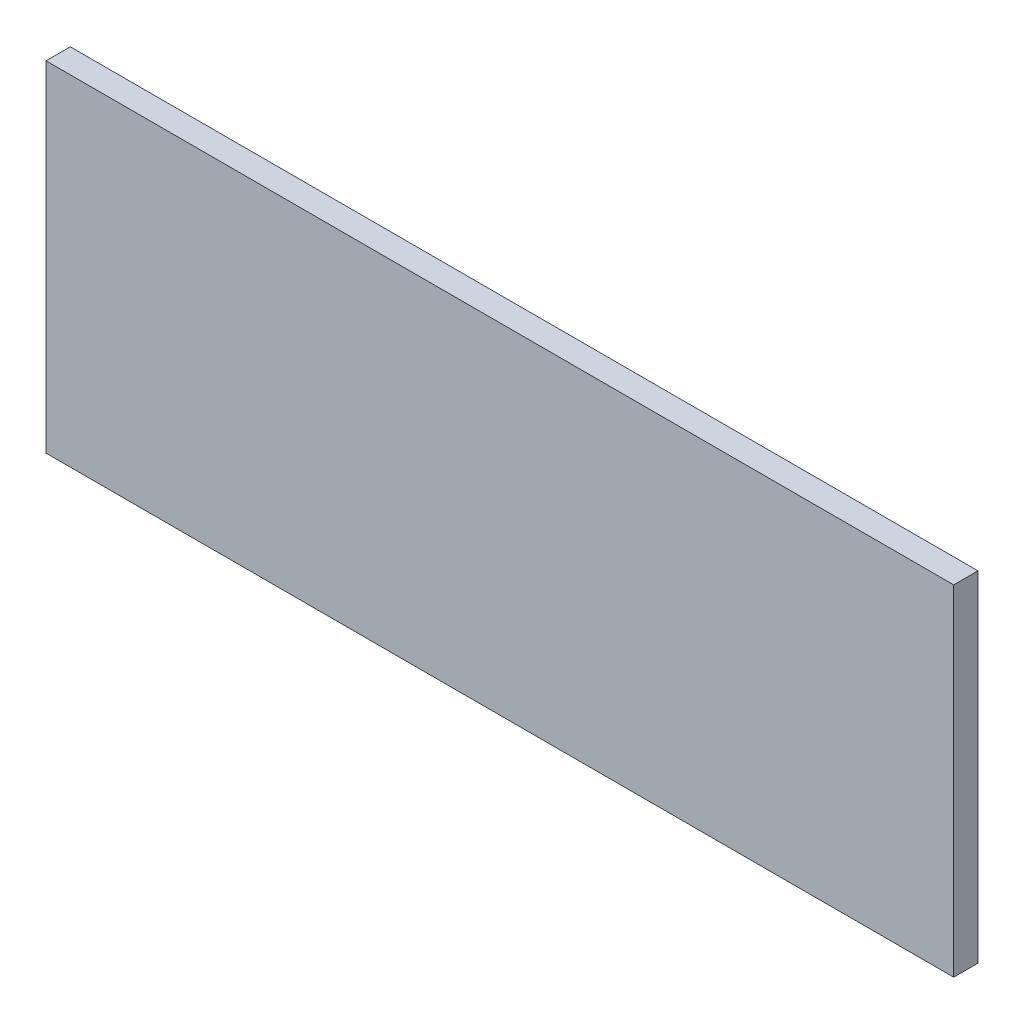
from build123d import *

# Parameters (mm, degrees)
ESQUISSE1_W        = 374
ESQUISSE1_H        = 140
BOSS_EXTRU_1_DEPTH = 10


with BuildPart() as part:
    # Esquisse1 → Boss.-Extru.1 (new body)
    with BuildSketch(Plane.XY):
        with Locations((187, 70)):
            Rectangle(ESQUISSE1_W, ESQUISSE1_H)
    extrude(amount=BOSS_EXTRU_1_DEPTH)


solid = part.part
